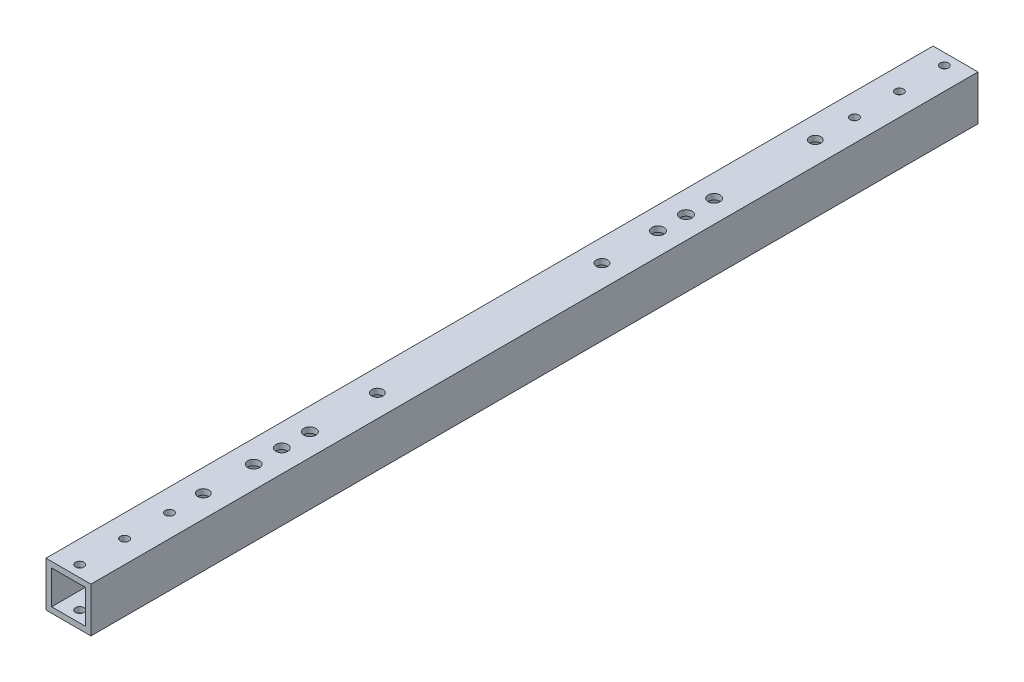
from build123d import *

# Parameters (mm, degrees)
SKETCH1_W                       = 25.4
SKETCH1_H                       = 25.4
SKETCH1_W_2                     = 19.05
SKETCH1_H_2                     = 19.05
EXTRUDE_THIN1_DEPTH             = 501.65
F_3_16_0_1875_DIAMETER_HOLE1_D  = 4.7625
F_1_4_0_25_DIAMETER_HOLE1_D     = 6.35
F_1_4_0_25_DIAMETER_HOLE1_DEPTH = 25.4
F_1_4_0_25_DIAMETER_HOLE1_TIP   = 1.907732465
F_1_4_CLEARANCE_HOLE1_D         = 6.7564
F_1_4_CLEARANCE_HOLE1_DEPTH     = 38.1
F_1_4_CLEARANCE_HOLE1_TIP       = 2.029827343


with BuildPart() as part:
    # Sketch1 → Extrude-Thin1 (new body)
    with BuildSketch(Plane.XY):
        Rectangle(SKETCH1_W, SKETCH1_H)
        Rectangle(SKETCH1_W_2, SKETCH1_H_2, mode=Mode.SUBTRACT)
    extrude(amount=EXTRUDE_THIN1_DEPTH)

    # 3/16 (0.1875) Diameter Hole1 (through all)
    with Locations(Plane(origin=(0, 12.7, 495.3), x_dir=(0, 0, 1), z_dir=(0, 1, 0))):
        with Locations((0, 0), (-488.95, 0), (-463.55, 0), (-438.15, 0), (-25.4, 0), (-50.8, 0)):
            Hole(F_3_16_0_1875_DIAMETER_HOLE1_D / 2)

    # 1/4 (0.25) Diameter Hole1
    with Locations(Plane(origin=(0, 12.7, 0), x_dir=(1, 0, 0), z_dir=(0, 1, 0))):
        with Locations((0, -79.3), (0, -425.402853021), (0, -326.968040355), (0, -199.95)):
            Hole(F_1_4_0_25_DIAMETER_HOLE1_D / 2, depth=F_1_4_0_25_DIAMETER_HOLE1_DEPTH)
            with Locations((0, 0, -(F_1_4_0_25_DIAMETER_HOLE1_DEPTH + F_1_4_0_25_DIAMETER_HOLE1_TIP / 2))):  # 118° drill point
                Cone(0, F_1_4_0_25_DIAMETER_HOLE1_D / 2, F_1_4_0_25_DIAMETER_HOLE1_TIP, mode=Mode.SUBTRACT)

    # 1/4 Clearance Hole1
    with Locations(Plane(origin=(381, 12.7, 250.825), x_dir=(1, 0, 0), z_dir=(0, 1, 0))):
        with Locations((381, 82.55), (381, 98.425), (381, 114.3), (381, -146.05), (381, -130.175), (381, -114.3), (-381, -146.05), (-381, -130.175), (-381, -114.3), (-381, 82.55), (-381, 98.425), (-381, 114.3)):
            Hole(F_1_4_CLEARANCE_HOLE1_D / 2, depth=F_1_4_CLEARANCE_HOLE1_DEPTH)
            with Locations((0, 0, -(F_1_4_CLEARANCE_HOLE1_DEPTH + F_1_4_CLEARANCE_HOLE1_TIP / 2))):  # 118° drill point
                Cone(0, F_1_4_CLEARANCE_HOLE1_D / 2, F_1_4_CLEARANCE_HOLE1_TIP, mode=Mode.SUBTRACT)


solid = part.part
